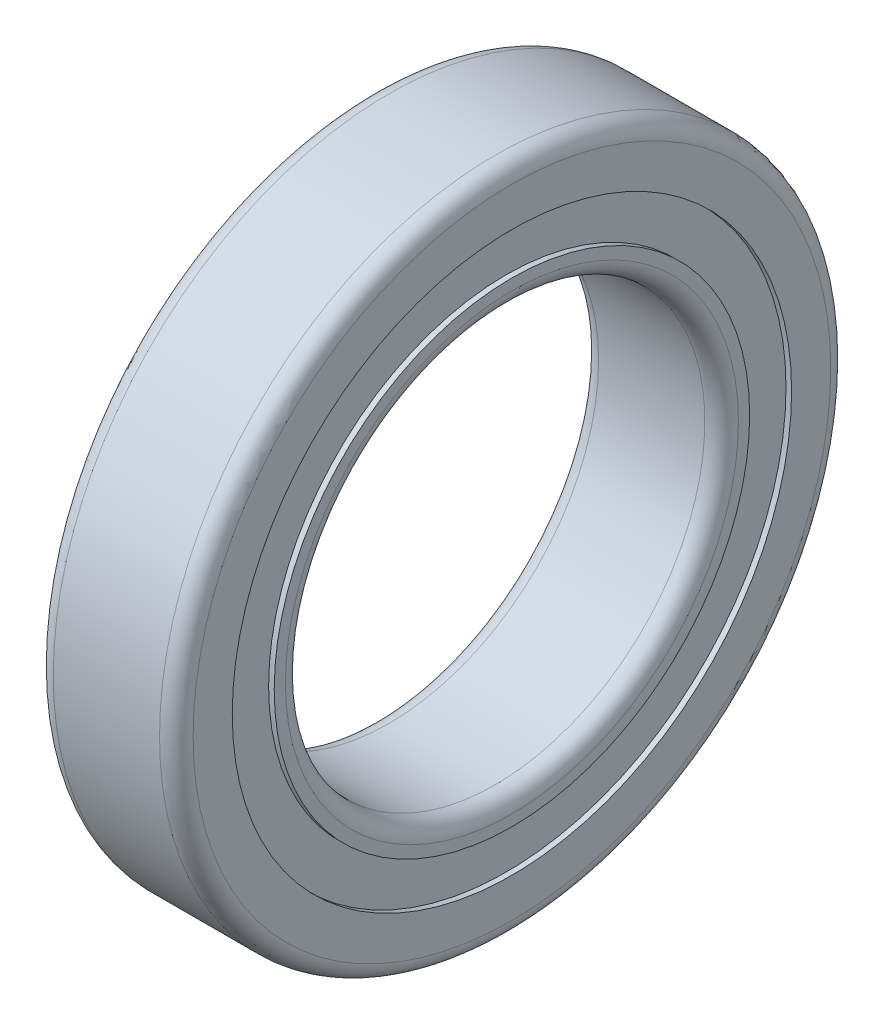
from build123d import *

# Parameters (mm, degrees)
FILLET1_R = 0.6


with BuildPart() as part:
    # Sketch1 → Revolve1 (revolve)
    with BuildSketch(Plane.XY, mode=Mode.PRIVATE) as revolve1_sk:
        Polygon((0, 8.5), (0, 7.5), (5, 7.5), (5, 8.5), (4.8, 8.5), (4.8, 10), (5, 10), (5, 12), (0, 12), (0, 10), (0.2, 10), (0.2, 8.5), align=None)
    revolve(revolve1_sk.sketch.rotate(Axis((0, 0, 0), (1, 0, 0)), 90), axis=Axis((0, 0, 0), (1, 0, 0)))

    # Fillet1
    fillet1_edges = [part.edges().sort_by_distance(p)[0] for p in [
        (5, 0, -12),
        (5, 0, -7.5),
        (0, 0, -7.5),
        (0, 0, -12),
    ]]
    fillet(fillet1_edges, radius=FILLET1_R)


solid = part.part
